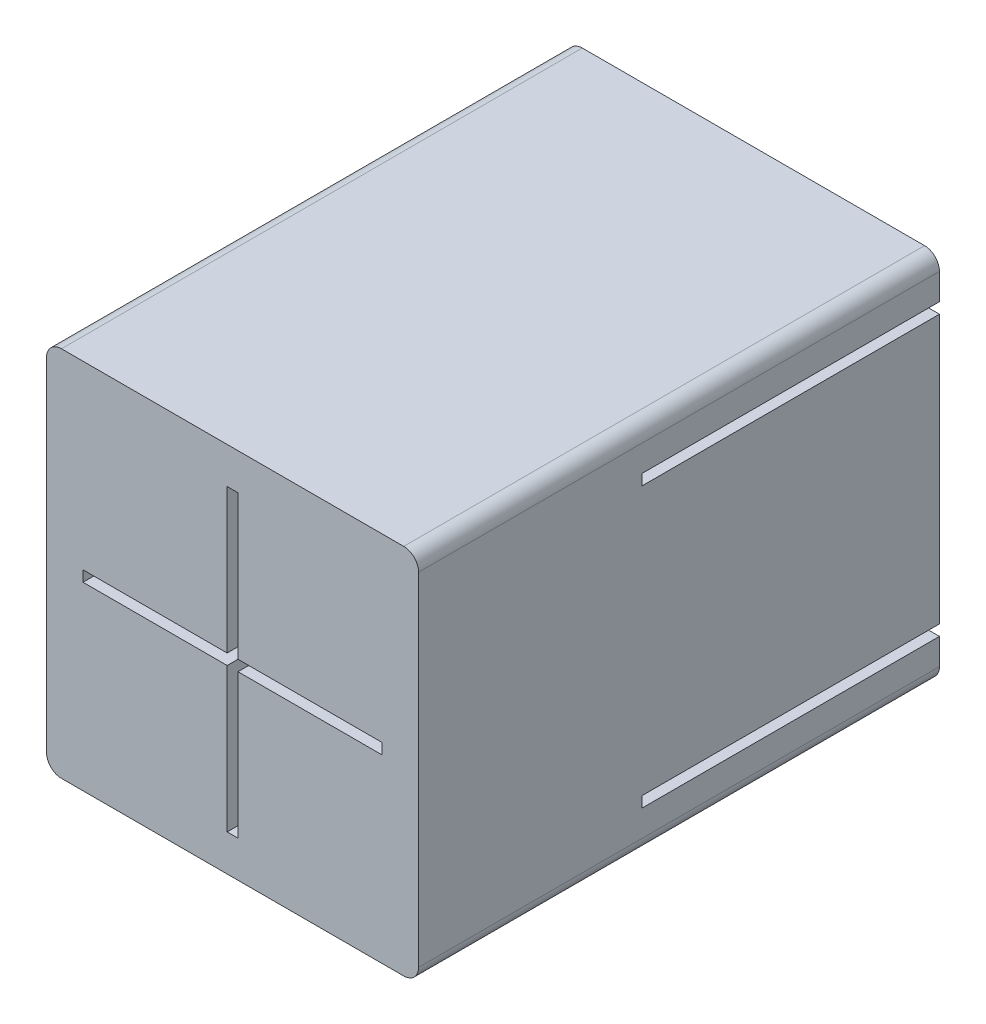
from build123d import *

# Parameters (mm, degrees)
SKETCH1_W           = 63.5
SKETCH1_H           = 63.5
BOSS_EXTRUDE1_DEPTH = 25.4
SKETCH1_7_W         = 63.5
SKETCH1_7_H         = 63.5
SKETCH1_7_W_2       = 24.60625
SKETCH1_7_H_2       = 1.8415
SKETCH1_7_W_3       = 1.8415
SKETCH1_7_H_3       = 24.60625
BOSS_EXTRUDE2_DEPTH = 63.5
CUT_EXTRUDE1_START  = -6.35
SKETCH2_W           = 50.8
SKETCH2_H           = 1.8415
CUT_EXTRUDE1_DEPTH  = 89.9
FILLET1_R           = 2.54


with BuildPart() as part:
    # Sketch1 → Boss-Extrude1 (new body)
    with BuildSketch(Plane.XY):
        Rectangle(SKETCH1_W, SKETCH1_H)
        Polygon((-0.92075, -0.92075), (-25.527, -0.92075), (-25.527, 0.92075), (-0.92075, 0.92075), (-0.92075, 25.527), (0.92075, 25.527), (0.92075, 0.92075), (25.527, 0.92075), (25.527, -0.92075), (0.92075, -0.92075), (0.92075, -25.527), (-0.92075, -25.527), align=None, mode=Mode.SUBTRACT)
    extrude(amount=BOSS_EXTRUDE1_DEPTH)

    # Sketch1<7> → Boss-Extrude2 (add)
    # profile 1 of 6: a face of its own
    with BuildSketch(Plane.XY):
        Rectangle(SKETCH1_7_W, SKETCH1_7_H)
        Polygon((-0.92075, -0.92075), (-25.527, -0.92075), (-25.527, 0.92075), (-0.92075, 0.92075), (-0.92075, 25.527), (0.92075, 25.527), (0.92075, 0.92075), (25.527, 0.92075), (25.527, -0.92075), (0.92075, -0.92075), (0.92075, -25.527), (-0.92075, -25.527), align=None, mode=Mode.SUBTRACT)
    # profile 2 of 6: a face of its own
    with BuildSketch(Plane.XY):
        with Locations((-13.223875, 0)):
            Rectangle(SKETCH1_7_W_2, SKETCH1_7_H_2)
    # profile 3 of 6: a face of its own
    with BuildSketch(Plane.XY):
        with Locations((13.223875, 0)):
            Rectangle(SKETCH1_7_W_2, SKETCH1_7_H_2)
    # profile 4 of 6: a face of its own
    with BuildSketch(Plane.XY):
        with Locations((0, -13.223875)):
            Rectangle(SKETCH1_7_W_3, SKETCH1_7_H_3)
    # profile 5 of 6: a face of its own
    with BuildSketch(Plane.XY):
        with Locations((0, 13.223875)):
            Rectangle(SKETCH1_7_W_3, SKETCH1_7_H_3)
    # profile 6 of 6: a face of its own
    with BuildSketch(Plane.XY):
        Rectangle(SKETCH1_7_W_3, SKETCH1_7_H_2)
    extrude(amount=-BOSS_EXTRUDE2_DEPTH)

    # Sketch2 → Cut-Extrude1 (cut, through all)
    with BuildSketch(Plane.ZY.offset(31.75).offset(CUT_EXTRUDE1_START)):
        with Locations((-38.1, 23.8125)):
            Rectangle(SKETCH2_W, SKETCH2_H)
        with Locations((-38.1, -23.8125)):
            Rectangle(SKETCH2_W, SKETCH2_H)
    extrude(amount=-CUT_EXTRUDE1_DEPTH, mode=Mode.SUBTRACT)

    # Fillet1
    fillet1_edges = [part.edges().sort_by_distance(p)[0] for p in [
        (31.75, 31.75, -19.05),
        (31.75, -31.75, -19.05),
        (-31.75, -31.75, -19.05),
        (-31.75, 31.75, -19.05),
    ]]
    fillet(fillet1_edges, radius=FILLET1_R)


solid = part.part
